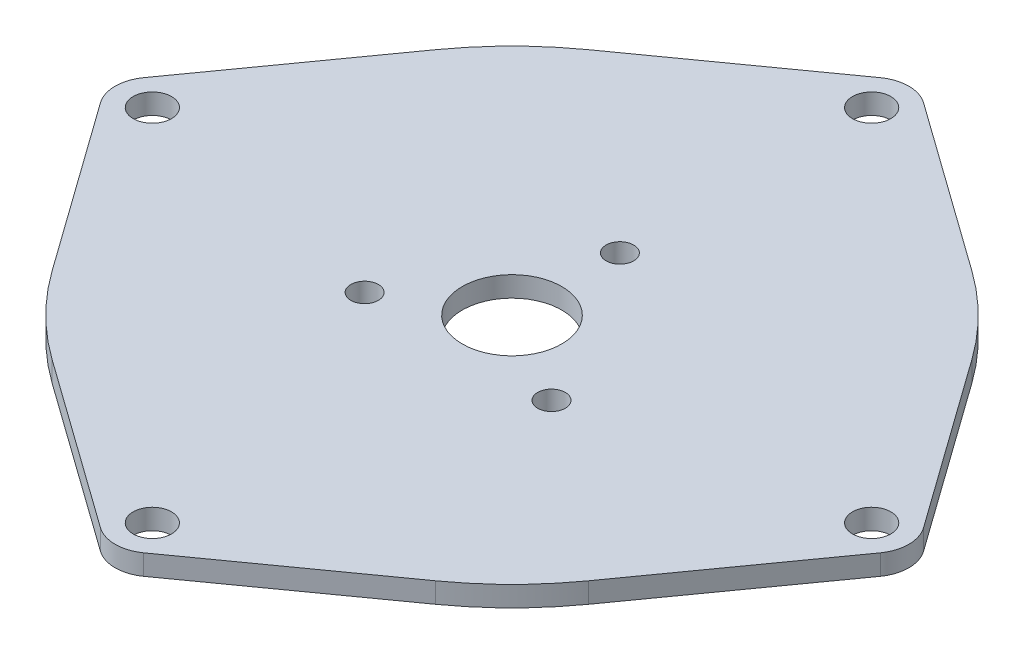
from build123d import *

# Parameters (mm, degrees)
SKETCH1_R           = 1.6
SKETCH1_R_2         = 1.15
SKETCH1_R_3         = 4.15
BOSS_EXTRUDE2_DEPTH = 1.7


with BuildPart() as part:
    # Sketch1 → Boss-Extrude2 (new body)
    with BuildSketch(Plane(origin=(0, 0, 0), x_dir=(1, 0, 0), z_dir=(0, 1, 0))):
        with BuildLine():
            Line((1.803573736, -32.521333333), (15.999444435, -22.366666667))
            ThreePointArc((15.999444435, -22.366666667), (19.445436483, -19.445436483), (22.366666667, -15.999444435))
            Line((22.366666667, -15.999444435), (32.521333333, -1.803573736))
            ThreePointArc((32.521333333, -1.803573736), (33.1, 0), (32.521333333, 1.803573736))
            Line((32.521333333, 1.803573736), (22.366666667, 15.999444435))
            ThreePointArc((22.366666667, 15.999444435), (19.445436483, 19.445436483), (15.999444435, 22.366666667))
            Line((15.999444435, 22.366666667), (1.803573736, 32.521333333))
            ThreePointArc((1.803573736, 32.521333333), (0, 33.1), (-1.803573736, 32.521333333))
            Line((-1.803573736, 32.521333333), (-15.999444435, 22.366666667))
            ThreePointArc((-15.999444435, 22.366666667), (-19.445436483, 19.445436483), (-22.366666667, 15.999444435))
            Line((-22.366666667, 15.999444435), (-32.521333333, 1.803573736))
            ThreePointArc((-32.521333333, 1.803573736), (-33.1, 0), (-32.521333333, -1.803573736))
            Line((-32.521333333, -1.803573736), (-22.366666667, -15.999444435))
            ThreePointArc((-22.366666667, -15.999444435), (-19.445436483, -19.445436483), (-15.999444435, -22.366666667))
            Line((-15.999444435, -22.366666667), (-1.803573736, -32.521333333))
            ThreePointArc((-1.803573736, -32.521333333), (0, -33.1), (1.803573736, -32.521333333))
        make_face()
        with Locations(Location((0, -30, 0), (0, 0, 270))):
            Circle(SKETCH1_R, mode=Mode.SUBTRACT)
        with Locations(Location((0, 9, 0), (0, 0, 270))):
            Circle(SKETCH1_R_2, mode=Mode.SUBTRACT)
        with Locations(Location((-7.794228634, -4.5, 0), (0, 0, 270))):
            Circle(SKETCH1_R_2, mode=Mode.SUBTRACT)
        with Locations(Location((7.794228634, -4.5, 0), (0, 0, 270))):
            Circle(SKETCH1_R_2, mode=Mode.SUBTRACT)
        with Locations(Location((0, 0, 0), (0, 0, 270))):
            Circle(SKETCH1_R_3, mode=Mode.SUBTRACT)
        with Locations(Location((30, 0, 0), (0, 0, 270))):
            Circle(SKETCH1_R, mode=Mode.SUBTRACT)
        with Locations(Location((-30, 0, 0), (0, 0, 270))):
            Circle(SKETCH1_R, mode=Mode.SUBTRACT)
        with Locations(Location((0, 30, 0), (0, 0, 270))):
            Circle(SKETCH1_R, mode=Mode.SUBTRACT)
    extrude(amount=BOSS_EXTRUDE2_DEPTH)


solid = part.part
